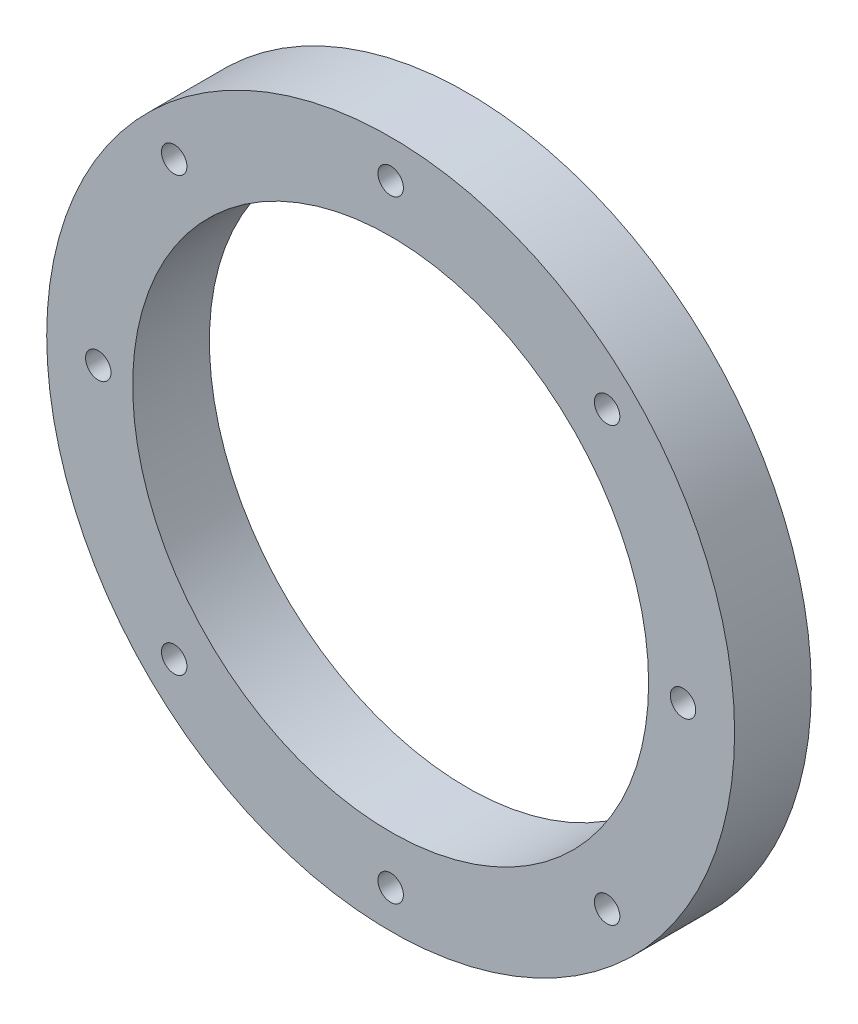
from build123d import *

# Parameters (mm, degrees)
SKETCH_1_R      = 50
SKETCH_1_R_2    = 37.5
SKETCH_1_R_3    = 1.85
EXTRUDE_1_DEPTH = 11.15


with BuildPart() as part:
    # 草图1 → 凸台-拉伸1 (new body)
    with BuildSketch(Plane.XY):
        Circle(SKETCH_1_R)
        Circle(SKETCH_1_R_2, mode=Mode.SUBTRACT)
        with Locations((42.5, 0)):
            Circle(SKETCH_1_R_3, mode=Mode.SUBTRACT)
        with Locations((-42.5, 0)):
            Circle(SKETCH_1_R_3, mode=Mode.SUBTRACT)
        with Locations((0, 44.5)):
            Circle(SKETCH_1_R_3, mode=Mode.SUBTRACT)
        with Locations((31.466251763, 31.466251763)):
            Circle(SKETCH_1_R_3, mode=Mode.SUBTRACT)
        with Locations((31.466251763, -31.466251763)):
            Circle(SKETCH_1_R_3, mode=Mode.SUBTRACT)
        with Locations((0, -44.5)):
            Circle(SKETCH_1_R_3, mode=Mode.SUBTRACT)
        with Locations((-31.466251763, -31.466251763)):
            Circle(SKETCH_1_R_3, mode=Mode.SUBTRACT)
        with Locations((-31.466251763, 31.466251763)):
            Circle(SKETCH_1_R_3, mode=Mode.SUBTRACT)
    extrude(amount=EXTRUDE_1_DEPTH)


solid = part.part
